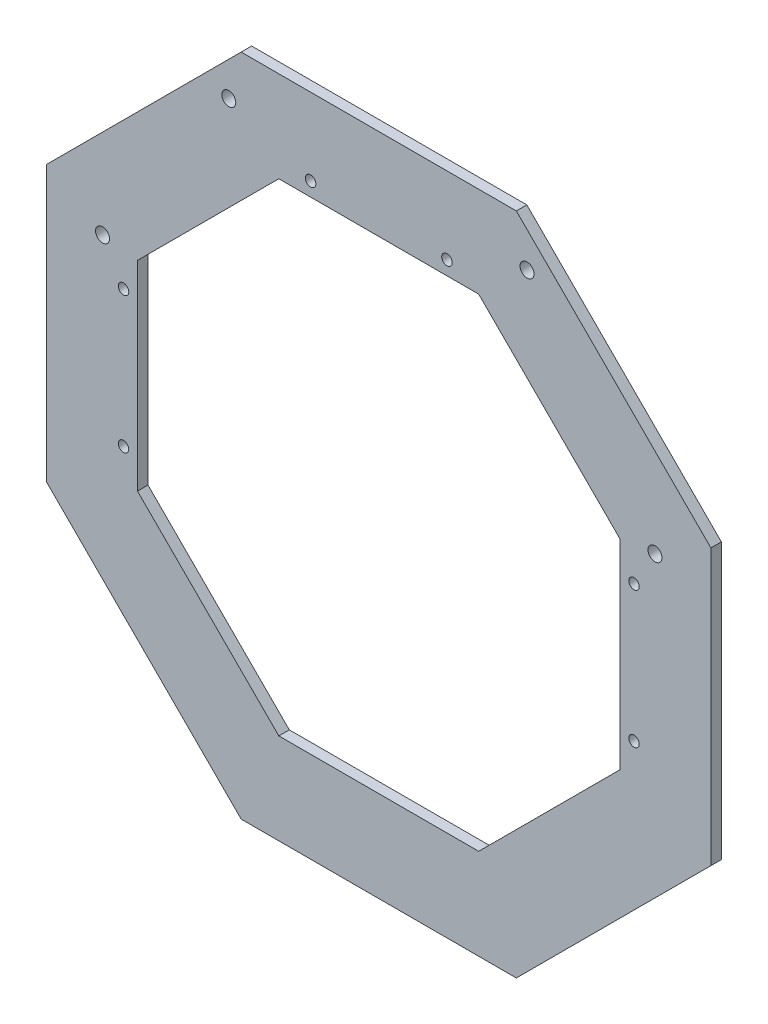
from build123d import *

# Parameters (mm, degrees)
SALIENTE_EXTRUIR1_DEPTH = 3
CORTAR_EXTRUIR1_DEPTH   = 3
CROQUIS3_R              = 1.5
CORTAR_EXTRUIR2_DEPTH   = 135.383778783
CROQUIS5_R              = 2
CORTAR_EXTRUIR3_DEPTH   = 135.383778783


with BuildPart() as part:
    # Croquis1 → Saliente-Extruir1 (new body)
    with BuildSketch(Plane.XY):
        Polygon((-39.350288425, -95), (39.350288425, -95), (95, -39.350288425), (95, 39.350288425), (39.350288425, 95), (-39.350288425, 95), (-95, 39.350288425), (-95, -39.350288425), align=None)
    extrude(amount=SALIENTE_EXTRUIR1_DEPTH)

    # Croquis2 → Cortar-Extruir1 (cut)
    with BuildSketch(Plane(origin=(0, 0, 0), x_dir=(-1, 0, 0), z_dir=(0, 0, -1))):
        Polygon((-69, -28.580735804), (-28.580735804, -69), (28.580735804, -69), (69, -28.580735804), (69, 28.580735804), (28.580735804, 69), (-28.580735804, 69), (-69, 28.580735804), align=None)
    extrude(amount=-CORTAR_EXTRUIR1_DEPTH, mode=Mode.SUBTRACT)

    # Croquis3 → Cortar-Extruir2 (cut, through all)
    with BuildSketch(Plane(origin=(0, 0, 0), x_dir=(-1, 0, 0), z_dir=(0, 0, -1))):
        with Locations((-19.5, 73)):
            Circle(CROQUIS3_R)
        with Locations((19.5, 73)):
            Circle(CROQUIS3_R)
        with Locations((-73, 19.5)):
            Circle(CROQUIS3_R)
        with Locations((-73, -19.5)):
            Circle(CROQUIS3_R)
        with Locations(Location((73, 19.5, 0), (0, 0, 180))):
            Circle(CROQUIS3_R)
        with Locations(Location((73, -19.5, 0), (0, 0, 180))):
            Circle(CROQUIS3_R)
    extrude(amount=-CORTAR_EXTRUIR2_DEPTH, mode=Mode.SUBTRACT)

    # Croquis5 → Cortar-Extruir3 (cut, through all)
    with BuildSketch(Plane.XY.offset(3)):
        with Locations((-42.892214845, 81.7)):
            Circle(CROQUIS5_R)
        with Locations((42.409372133, 81.9)):
            Circle(CROQUIS5_R)
        with Locations((-79, 29.894444303)):
            Circle(CROQUIS5_R)
        with Locations(Location((79, 29.894444303, 0), (0, 0, 180))):
            Circle(CROQUIS5_R)
    extrude(amount=-CORTAR_EXTRUIR3_DEPTH, mode=Mode.SUBTRACT)


solid = part.part
